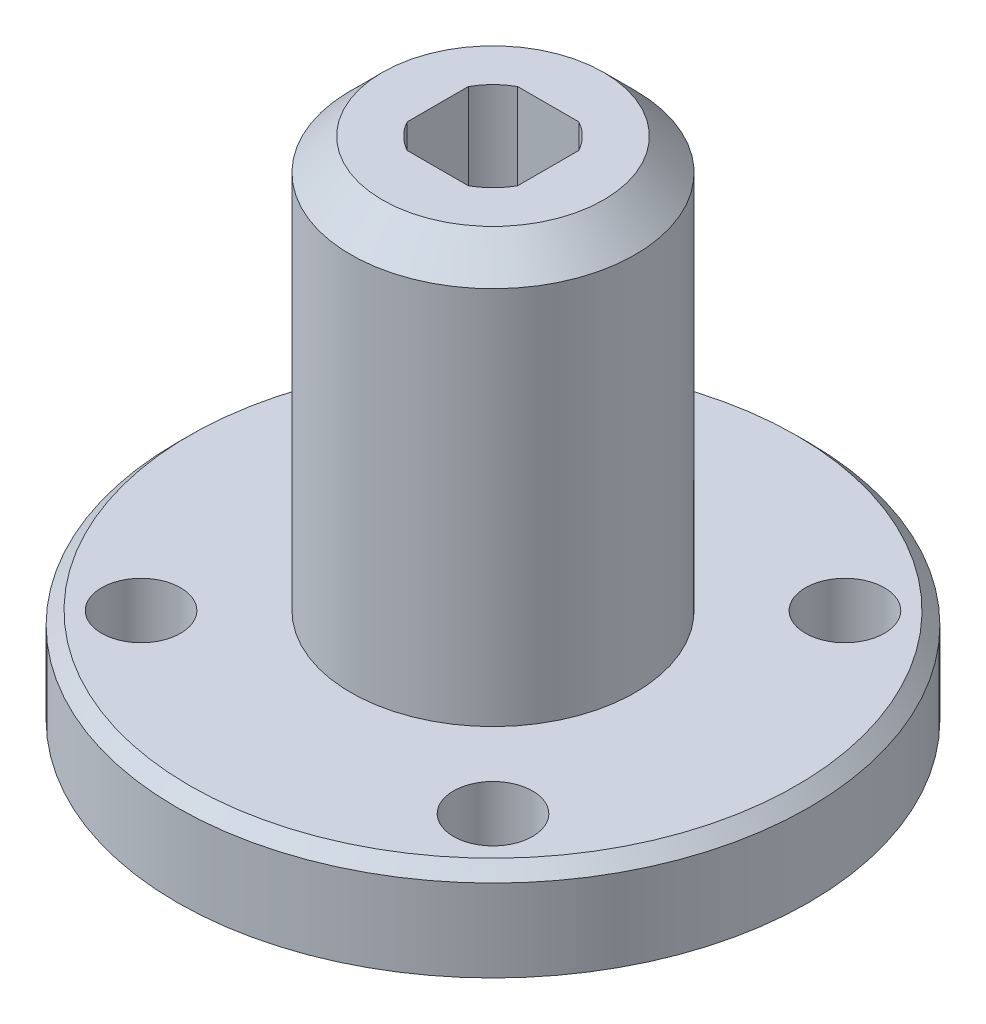
from build123d import *

# Parameters (mm, degrees)
SKETCH_1_R      = 20
SKETCH_1_R_2    = 2.5
EXTRUDE_1_DEPTH = 6
SKETCH_2_R      = 9
EXTRUDE_2_DEPTH = 26
CHAMFER_1_SIZE  = 0.8
CHAMFER_2_SIZE  = 2


with BuildPart() as part:
    # 草图1 → 凸台-拉伸1 (new body)
    with BuildSketch(Plane(origin=(0, 0, 0), x_dir=(1, 0, 0), z_dir=(0, 1, 0))):
        with Locations(Location((0, 0, 0), (0, 0, 270))):
            Circle(SKETCH_1_R)
        with Locations(Location((-11.136931804, 11.136931804, 0), (0, 0, 270))):
            Circle(SKETCH_1_R_2, mode=Mode.SUBTRACT)
        with Locations(Location((11.136931804, 11.136931804, 0), (0, 0, 270))):
            Circle(SKETCH_1_R_2, mode=Mode.SUBTRACT)
        with Locations(Location((11.136931804, -11.136931804, 0), (0, 0, 270))):
            Circle(SKETCH_1_R_2, mode=Mode.SUBTRACT)
        with Locations(Location((-11.136931804, -11.136931804, 0), (0, 0, 270))):
            Circle(SKETCH_1_R_2, mode=Mode.SUBTRACT)
    extrude(amount=EXTRUDE_1_DEPTH)

    # 草图2 → 凸台-拉伸2 (add)
    with BuildSketch(Plane(origin=(0, 6, 0), x_dir=(1, 0, 0), z_dir=(0, 1, 0))):
        with Locations(Location((0, 0, 0), (0, 0, 90))):
            Circle(SKETCH_2_R)
        with BuildLine():
            Line((1.936491673, 3.5), (-1.936491673, 3.5))
            ThreePointArc((-1.936491673, 3.5), (-2.828427125, 2.828427125), (-3.5, 1.936491673))
            Line((-3.5, 1.936491673), (-3.5, -1.936491673))
            ThreePointArc((-3.5, -1.936491673), (-2.828427125, -2.828427125), (-1.936491673, -3.5))
            Line((-1.936491673, -3.5), (1.936491673, -3.5))
            ThreePointArc((1.936491673, -3.5), (2.828427125, -2.828427125), (3.5, -1.936491673))
            Line((3.5, -1.936491673), (3.5, 1.936491673))
            ThreePointArc((3.5, 1.936491673), (2.828427125, 2.828427125), (1.936491673, 3.5))
        make_face(mode=Mode.SUBTRACT)
    extrude(amount=EXTRUDE_2_DEPTH)

    # 倒角1
    chamfer_1_edges = [part.edges().sort_by_distance(p)[0] for p in [
        (0, 6, -20),
    ]]
    chamfer(chamfer_1_edges, length=CHAMFER_1_SIZE)

    # 倒角2
    chamfer_2_edges = [part.edges().sort_by_distance(p)[0] for p in [
        (0, 32, 9),
    ]]
    chamfer(chamfer_2_edges, length=CHAMFER_2_SIZE)


solid = part.part
